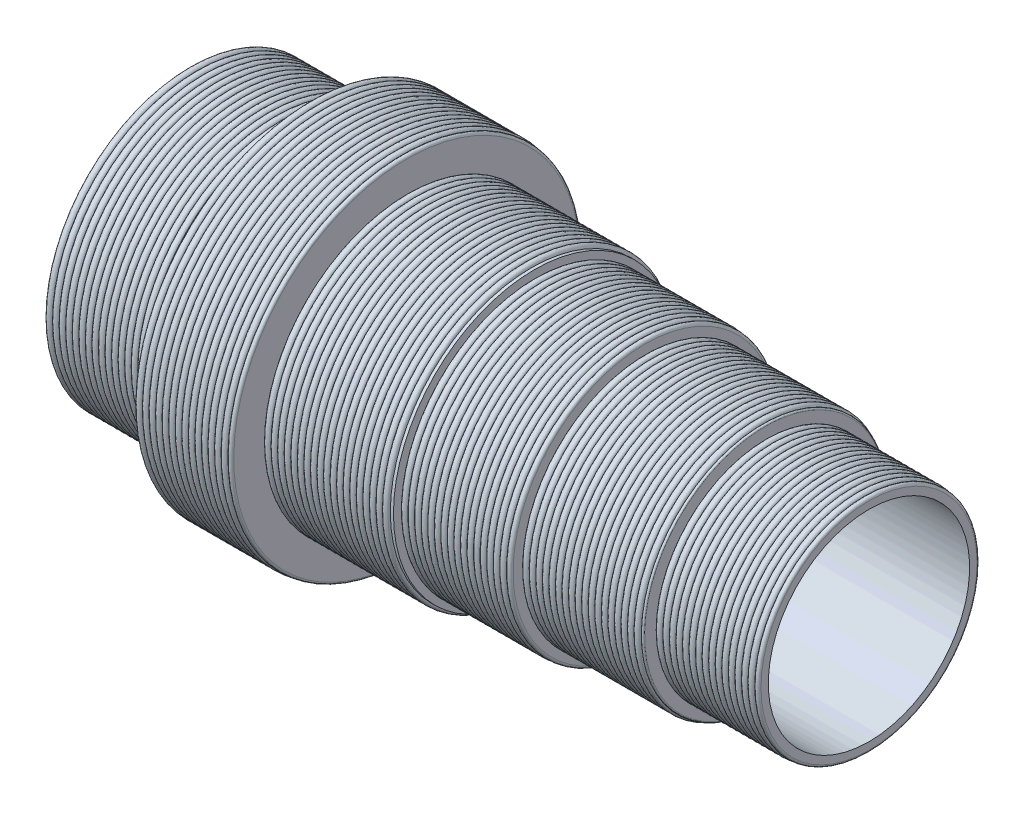
from build123d import *


with BuildPart() as part:
    # Croquis1 → Revolución1 (revolve)
    with BuildSketch(Plane.XY):
        with BuildLine():
            Line((-98.51, 41.285), (-98.51, 29.195))
            Line((-98.51, 29.195), (-63.51, 29.195))
            Line((-63.51, 29.195), (-63.51, 41.285))
            Line((-63.51, 41.285), (-64.31, 41.285))
            ThreePointArc((-64.31, 41.285), (-65.26, 42.235), (-66.21, 41.285))
            ThreePointArc((-66.21, 41.285), (-67.16, 42.235), (-68.11, 41.285))
            ThreePointArc((-68.11, 41.285), (-69.06, 42.235), (-70.01, 41.285))
            ThreePointArc((-70.01, 41.285), (-70.96, 42.235), (-71.91, 41.285))
            ThreePointArc((-71.91, 41.285), (-72.86, 42.235), (-73.81, 41.285))
            ThreePointArc((-73.81, 41.285), (-74.76, 42.235), (-75.71, 41.285))
            ThreePointArc((-75.71, 41.285), (-76.66, 42.235), (-77.61, 41.285))
            ThreePointArc((-77.61, 41.285), (-78.56, 42.235), (-79.51, 41.285))
            ThreePointArc((-79.51, 41.285), (-80.46, 42.235), (-81.41, 41.285))
            ThreePointArc((-81.41, 41.285), (-82.36, 42.235), (-83.31, 41.285))
            ThreePointArc((-83.31, 41.285), (-84.26, 42.235), (-85.21, 41.285))
            ThreePointArc((-85.21, 41.285), (-86.16, 42.235), (-87.11, 41.285))
            ThreePointArc((-87.11, 41.285), (-88.06, 42.235), (-89.01, 41.285))
            ThreePointArc((-89.01, 41.285), (-89.96, 42.235), (-90.91, 41.285))
            ThreePointArc((-90.91, 41.285), (-91.86, 42.235), (-92.81, 41.285))
            ThreePointArc((-92.81, 41.285), (-93.76, 42.235), (-94.71, 41.285))
            ThreePointArc((-94.71, 41.285), (-95.66, 42.235), (-96.61, 41.285))
            ThreePointArc((-96.61, 41.285), (-97.56, 42.235), (-98.51, 41.285))
        make_face()
    revolve(axis=Axis((-105, 0, 0), (1, 0, 0)))

    # Croquis1<4> → Revolución2 (revolve)
    with BuildSketch(Plane.XY):
        with BuildLine():
            Line((-63.51, 41.285), (-63.51, 29.195))
            Line((-63.51, 29.195), (-35.51, 29.195))
            Line((-35.51, 29.195), (-35.51, 40.915))
            Line((-35.51, 40.915), (-35.51, 50.215))
            ThreePointArc((-35.51, 50.215), (-36.21, 50.915), (-36.91, 50.215))
            ThreePointArc((-36.91, 50.215), (-37.86, 51.165), (-38.81, 50.215))
            ThreePointArc((-38.81, 50.215), (-39.76, 51.165), (-40.71, 50.215))
            ThreePointArc((-40.71, 50.215), (-41.66, 51.165), (-42.61, 50.215))
            ThreePointArc((-42.61, 50.215), (-43.56, 51.165), (-44.51, 50.215))
            ThreePointArc((-44.51, 50.215), (-45.46, 51.165), (-46.41, 50.215))
            ThreePointArc((-46.41, 50.215), (-47.36, 51.165), (-48.31, 50.215))
            ThreePointArc((-48.31, 50.215), (-49.26, 51.165), (-50.21, 50.215))
            ThreePointArc((-50.21, 50.215), (-51.16, 51.165), (-52.11, 50.215))
            ThreePointArc((-52.11, 50.215), (-53.06, 51.165), (-54.01, 50.215))
            ThreePointArc((-54.01, 50.215), (-54.96, 51.165), (-55.91, 50.215))
            ThreePointArc((-55.91, 50.215), (-56.86, 51.165), (-57.81, 50.215))
            ThreePointArc((-57.81, 50.215), (-58.76, 51.165), (-59.71, 50.215))
            ThreePointArc((-59.71, 50.215), (-60.66, 51.165), (-61.61, 50.215))
            ThreePointArc((-61.61, 50.215), (-62.56, 51.165), (-63.51, 50.215))
            Line((-63.51, 50.215), (-63.51, 41.285))
        make_face()
    revolve(axis=Axis((-105, 0, 0), (1, 0, 0)))

    # Croquis1<5> → Revolución3 (revolve)
    with BuildSketch(Plane.XY):
        with BuildLine():
            Line((-35.51, 40.915), (-35.51, 29.195))
            Line((-35.51, 29.195), (1.49, 29.195))
            Line((1.49, 29.195), (1.49, 38.195))
            Line((1.49, 38.195), (1.49, 40.915))
            Line((1.49, 40.915), (0.59, 40.915))
            ThreePointArc((0.59, 40.915), (-0.36, 41.865), (-1.31, 40.915))
            ThreePointArc((-1.31, 40.915), (-2.26, 41.865), (-3.21, 40.915))
            ThreePointArc((-3.21, 40.915), (-4.16, 41.865), (-5.11, 40.915))
            ThreePointArc((-5.11, 40.915), (-6.06, 41.865), (-7.01, 40.915))
            ThreePointArc((-7.01, 40.915), (-7.96, 41.865), (-8.91, 40.915))
            ThreePointArc((-8.91, 40.915), (-9.86, 41.865), (-10.81, 40.915))
            ThreePointArc((-10.81, 40.915), (-11.76, 41.865), (-12.71, 40.915))
            ThreePointArc((-12.71, 40.915), (-13.66, 41.865), (-14.61, 40.915))
            ThreePointArc((-14.61, 40.915), (-15.56, 41.865), (-16.51, 40.915))
            ThreePointArc((-16.51, 40.915), (-17.46, 41.865), (-18.41, 40.915))
            ThreePointArc((-18.41, 40.915), (-19.36, 41.865), (-20.31, 40.915))
            ThreePointArc((-20.31, 40.915), (-21.26, 41.865), (-22.21, 40.915))
            ThreePointArc((-22.21, 40.915), (-23.16, 41.865), (-24.11, 40.915))
            ThreePointArc((-24.11, 40.915), (-25.06, 41.865), (-26.01, 40.915))
            ThreePointArc((-26.01, 40.915), (-26.96, 41.865), (-27.91, 40.915))
            ThreePointArc((-27.91, 40.915), (-28.86, 41.865), (-29.81, 40.915))
            ThreePointArc((-29.81, 40.915), (-30.76, 41.865), (-31.71, 40.915))
            ThreePointArc((-31.71, 40.915), (-32.66, 41.865), (-33.61, 40.915))
            ThreePointArc((-33.61, 40.915), (-34.56, 41.865), (-35.51, 40.915))
        make_face()
    revolve(axis=Axis((-105, 0, 0), (1, 0, 0)))

    # Croquis1<6> → Revolución4 (revolve)
    with BuildSketch(Plane.XY):
        with BuildLine():
            Line((1.49, 38.195), (1.49, 29.195))
            Line((1.49, 29.195), (33.49, 29.195))
            Line((33.49, 29.195), (33.49, 35.055))
            Line((33.49, 35.055), (33.49, 38.195))
            ThreePointArc((33.49, 38.195), (32.69, 38.995), (31.89, 38.195))
            ThreePointArc((31.89, 38.195), (30.94, 39.145), (29.99, 38.195))
            ThreePointArc((29.99, 38.195), (29.04, 39.145), (28.09, 38.195))
            ThreePointArc((28.09, 38.195), (27.14, 39.145), (26.19, 38.195))
            ThreePointArc((26.19, 38.195), (25.24, 39.145), (24.29, 38.195))
            ThreePointArc((24.29, 38.195), (23.34, 39.145), (22.39, 38.195))
            ThreePointArc((22.39, 38.195), (21.44, 39.145), (20.49, 38.195))
            ThreePointArc((20.49, 38.195), (19.54, 39.145), (18.59, 38.195))
            ThreePointArc((18.59, 38.195), (17.64, 39.145), (16.69, 38.195))
            ThreePointArc((16.69, 38.195), (15.74, 39.145), (14.79, 38.195))
            ThreePointArc((14.79, 38.195), (13.84, 39.145), (12.89, 38.195))
            ThreePointArc((12.89, 38.195), (11.94, 39.145), (10.99, 38.195))
            ThreePointArc((10.99, 38.195), (10.04, 39.145), (9.09, 38.195))
            ThreePointArc((9.09, 38.195), (8.14, 39.145), (7.19, 38.195))
            ThreePointArc((7.19, 38.195), (6.24, 39.145), (5.29, 38.195))
            ThreePointArc((5.29, 38.195), (4.34, 39.145), (3.39, 38.195))
            ThreePointArc((3.39, 38.195), (2.44, 39.145), (1.49, 38.195))
        make_face()
    revolve(axis=Axis((-105, 0, 0), (1, 0, 0)))

    # Croquis1<7> → Revolución5 (revolve)
    with BuildSketch(Plane.XY):
        with BuildLine():
            Line((33.49, 35.055), (33.49, 29.195))
            Line((33.49, 29.195), (68.49, 29.195))
            Line((68.49, 29.195), (68.49, 31.315))
            Line((68.49, 31.315), (68.49, 35.055))
            ThreePointArc((68.49, 35.055), (68.09, 35.455), (67.69, 35.055))
            ThreePointArc((67.69, 35.055), (66.74, 36.005), (65.79, 35.055))
            ThreePointArc((65.79, 35.055), (64.84, 36.005), (63.89, 35.055))
            ThreePointArc((63.89, 35.055), (62.94, 36.005), (61.99, 35.055))
            ThreePointArc((61.99, 35.055), (61.04, 36.005), (60.09, 35.055))
            ThreePointArc((60.09, 35.055), (59.14, 36.005), (58.19, 35.055))
            ThreePointArc((58.19, 35.055), (57.24, 36.005), (56.29, 35.055))
            ThreePointArc((56.29, 35.055), (55.34, 36.005), (54.39, 35.055))
            ThreePointArc((54.39, 35.055), (53.44, 36.005), (52.49, 35.055))
            ThreePointArc((52.49, 35.055), (51.54, 36.005), (50.59, 35.055))
            ThreePointArc((50.59, 35.055), (49.64, 36.005), (48.69, 35.055))
            ThreePointArc((48.69, 35.055), (47.74, 36.005), (46.79, 35.055))
            ThreePointArc((46.79, 35.055), (45.84, 36.005), (44.89, 35.055))
            ThreePointArc((44.89, 35.055), (43.94, 36.005), (42.99, 35.055))
            ThreePointArc((42.99, 35.055), (42.04, 36.005), (41.09, 35.055))
            ThreePointArc((41.09, 35.055), (40.14, 36.005), (39.19, 35.055))
            ThreePointArc((39.19, 35.055), (38.24, 36.005), (37.29, 35.055))
            ThreePointArc((37.29, 35.055), (36.34, 36.005), (35.39, 35.055))
            ThreePointArc((35.39, 35.055), (34.44, 36.005), (33.49, 35.055))
        make_face()
    revolve(axis=Axis((-105, 0, 0), (1, 0, 0)))

    # Croquis1<8> → Revolución6 (revolve)
    with BuildSketch(Plane.XY):
        with BuildLine():
            Line((68.49, 31.315), (68.49, 29.195))
            Line((68.49, 29.195), (98.49, 29.195))
            Line((98.49, 29.195), (98.49, 31.315))
            ThreePointArc((98.49, 31.315), (97.74, 32.065), (96.99, 31.315))
            ThreePointArc((96.99, 31.315), (96.04, 32.265), (95.09, 31.315))
            ThreePointArc((95.09, 31.315), (94.14, 32.265), (93.19, 31.315))
            ThreePointArc((93.19, 31.315), (92.24, 32.265), (91.29, 31.315))
            ThreePointArc((91.29, 31.315), (90.34, 32.265), (89.39, 31.315))
            ThreePointArc((89.39, 31.315), (88.44, 32.265), (87.49, 31.315))
            ThreePointArc((87.49, 31.315), (86.54, 32.265), (85.59, 31.315))
            ThreePointArc((85.59, 31.315), (84.64, 32.265), (83.69, 31.315))
            ThreePointArc((83.69, 31.315), (82.74, 32.265), (81.79, 31.315))
            ThreePointArc((81.79, 31.315), (80.84, 32.265), (79.89, 31.315))
            ThreePointArc((79.89, 31.315), (78.94, 32.265), (77.99, 31.315))
            ThreePointArc((77.99, 31.315), (77.04, 32.265), (76.09, 31.315))
            ThreePointArc((76.09, 31.315), (75.14, 32.265), (74.19, 31.315))
            ThreePointArc((74.19, 31.315), (73.24, 32.265), (72.29, 31.315))
            ThreePointArc((72.29, 31.315), (71.34, 32.265), (70.39, 31.315))
            ThreePointArc((70.39, 31.315), (69.44, 32.265), (68.49, 31.315))
        make_face()
    revolve(axis=Axis((-105, 0, 0), (1, 0, 0)))


solid = part.part
